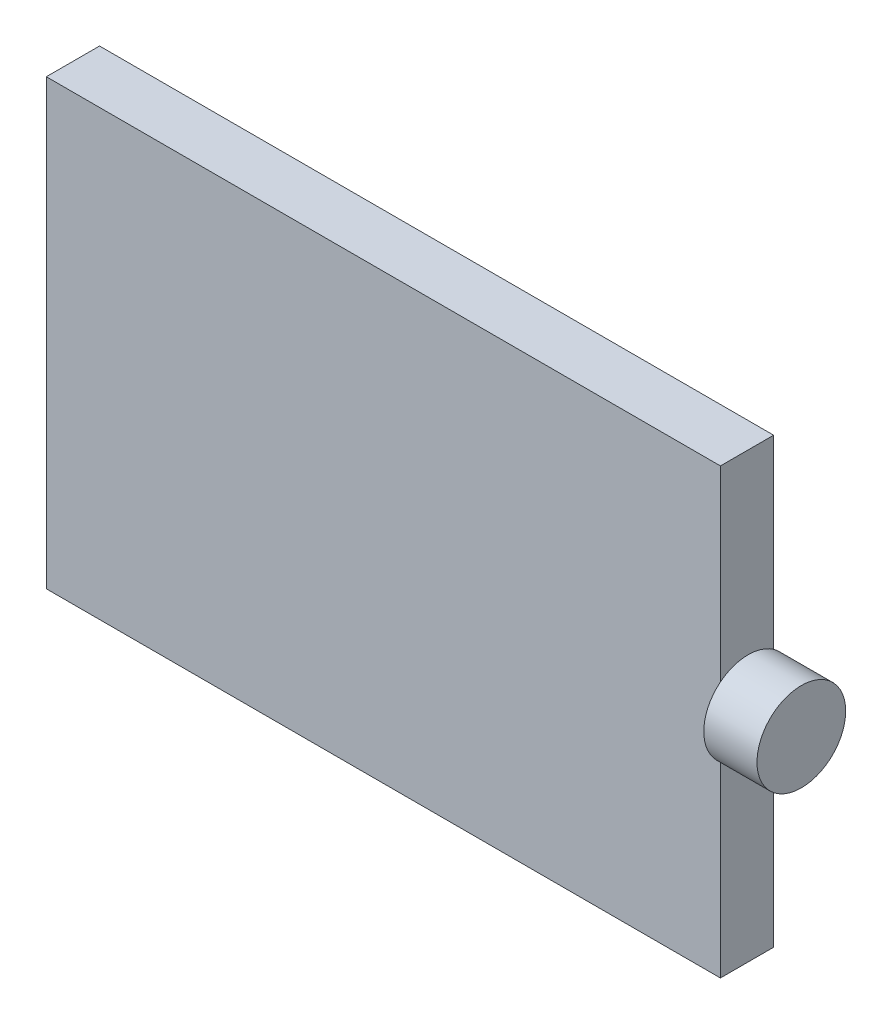
from build123d import *

# Parameters (mm, degrees)
SKETCH2_W           = 38
SKETCH2_H           = 25
BOSS_EXTRUDE1_DEPTH = 3
SKETCH3_R           = 2.5
BOSS_EXTRUDE2_DEPTH = 3


with BuildPart() as part:
    # Sketch2 → Boss-Extrude1 (new body)
    with BuildSketch(Plane.XY):
        Rectangle(SKETCH2_W, SKETCH2_H)
    extrude(amount=BOSS_EXTRUDE1_DEPTH)

    # Sketch3 → Boss-Extrude2 (add)
    with BuildSketch(Plane(origin=(19, 0, 0), x_dir=(0, 0, -1), z_dir=(1, 0, 0))):
        with Locations(Location((-1.4379318, 0, 0), (0, 0, 128.669511398))):
            Circle(SKETCH3_R)
    extrude(amount=BOSS_EXTRUDE2_DEPTH)


solid = part.part
